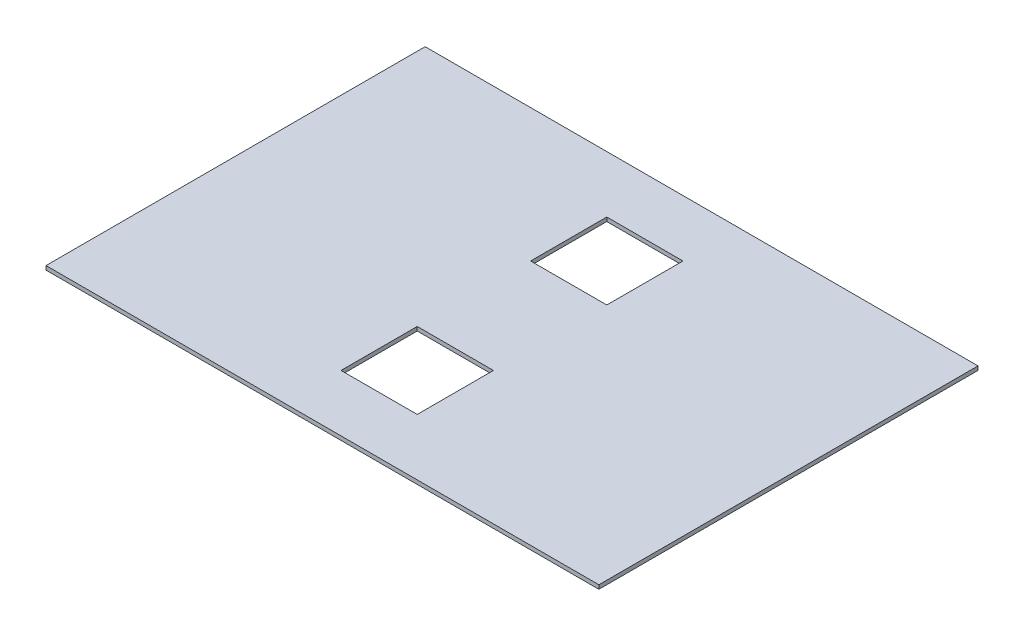
from build123d import *

# Parameters (mm, degrees)
SKETCH1_W           = 889
SKETCH1_H           = 609.6
BOSS_EXTRUDE1_DEPTH = 6.35
SKETCH2_W           = 122.5
SKETCH2_H           = 122.5
CUT_EXTRUDE1_DEPTH  = 540.002423464


with BuildPart() as part:
    # Sketch1 → Boss-Extrude1 (new body)
    with BuildSketch(Plane(origin=(0, 0, 0), x_dir=(1, 0, 0), z_dir=(0, 1, 0))):
        Rectangle(SKETCH1_W, SKETCH1_H)
    extrude(amount=BOSS_EXTRUDE1_DEPTH)

    # Sketch2 → Cut-Extrude1 (cut, through all)
    with BuildSketch(Plane(origin=(0, 6.35, 0), x_dir=(1, 0, 0), z_dir=(0, 1, 0))):
        with Locations((0, 152.4)):
            Rectangle(SKETCH2_W, SKETCH2_H)
        with Locations((0, -152.4)):
            Rectangle(SKETCH2_W, SKETCH2_H)
    extrude(amount=-CUT_EXTRUDE1_DEPTH, mode=Mode.SUBTRACT)


solid = part.part
